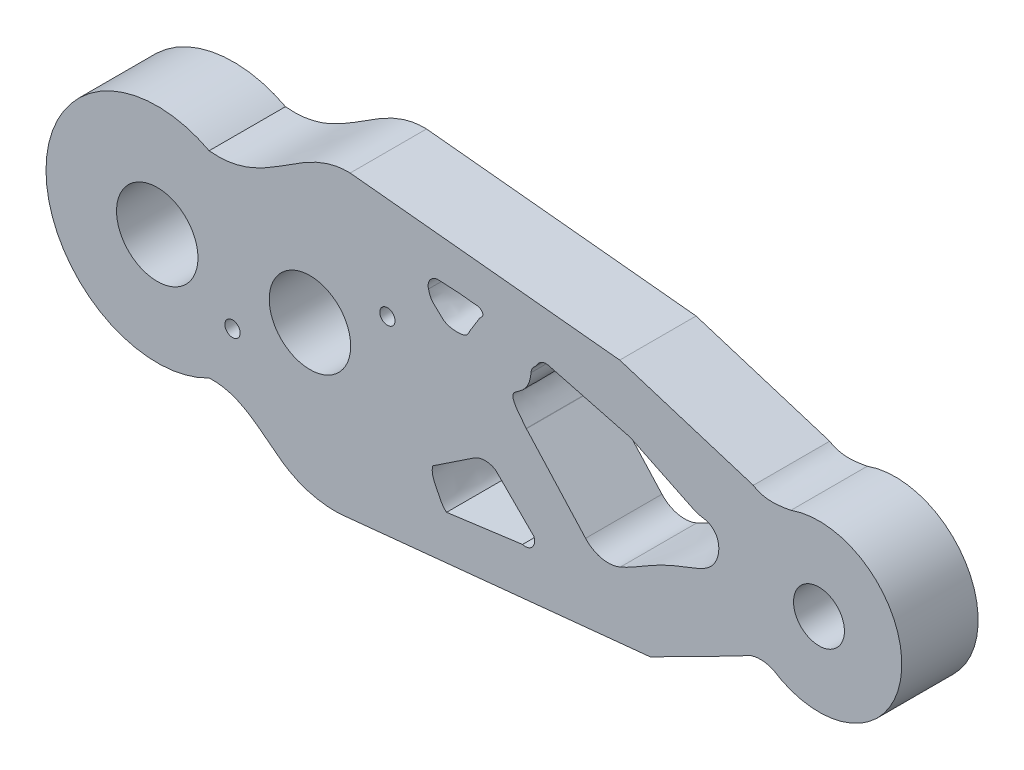
from build123d import *

# Parameters (mm, degrees)
SKETCH1_R               = 4
SKETCH1_R_2             = 2.5
BOSS_EXTRUDE1_DEPTH     = 3.75
CUT_EXTRUDE1_DEPTH      = 62.965246239
CUT_EXTRUDE1_DEPTH_BACK = 62.965246239
FILLET_1MM_R            = 1
FILLET_3MM_R            = 3
SKETCH4_R               = 0.75
SKETCH4_R_2             = 0.751178993
CUT_EXTRUDE2_DEPTH      = 61.458819785


with BuildPart() as part:
    # Sketch1 → Boss-Extrude1 (new, symmetric)
    with BuildSketch(Plane.XY):
        with BuildLine():
            Line((1.370602209, 14.9582984), (51.004064798, 9.949465005))
            ThreePointArc((51.004064798, 9.949465005), (60, 0), (51.004064798, -9.949465005))
            Line((51.004064798, -9.949465005), (1.370602209, -14.9582984))
            ThreePointArc((1.370602209, -14.9582984), (0.289429434, -15.018171395), (-0.793247409, -15))
            Line((-0.793247409, -15), (-15, -15))
            ThreePointArc((-15, -15), (-29.999996344, -0.010472716), (-15.020945427, 14.999985376))
            Line((-15.020945427, 14.999985376), (0, 15.020960071))
            ThreePointArc((0, 15.020960071), (0.686016928, 15.005286476), (1.370602209, 14.9582984))
        make_face()
        with Locations((-15, 0)):
            Circle(SKETCH1_R, mode=Mode.SUBTRACT)
        Circle(SKETCH1_R, mode=Mode.SUBTRACT)
        with Locations((50, 0)):
            Circle(SKETCH1_R_2, mode=Mode.SUBTRACT)
    extrude(amount=BOSS_EXTRUDE1_DEPTH, both=True)

    # Sketch3 → Cut-Extrude1 (cut, two sides: drawn at the far end of the back side and taken through both)
    with BuildSketch(Plane.XY.offset(-CUT_EXTRUDE1_DEPTH_BACK)):
        with BuildLine():
            add(Edge.make_bspline(
                [(-9.903552514, -9.666856323), (-7.476526803, -9.533199131), (-5.112477631, -11.33215709), (-1.419900227, -14.307798132), (1.248258646, -14.893104181), (3.011734347, -14.792681153)],
                knots=[0, 0, 0, 0, 0.454121396, 0.625343613, 1, 1, 1, 1], degree=3))
            Line((3.011734347, -14.792681153), (3.011734347, -19.334119217))
            Line((3.011734347, -19.334119217), (-33.098360308, -19.334119217))
            Line((-33.098360308, -19.334119217), (-33.098360308, 23.598998457))
            Line((-33.098360308, 23.598998457), (3.949930574, 23.598998457))
            Line((3.949930574, 23.598998457), (3.949930574, 14.69800171))
            add(Edge.make_bspline(
                [(-9.903552514, 9.666856323), (-6.652147518, 9.320096166), (-2.575157403, 12.180713674), (1.739923007, 14.763020307), (3.949930574, 14.69800171)],
                knots=[0, 0, 0, 0, 0.582391985, 1, 1, 1, 1], degree=3))
            ThreePointArc((-9.903552514, 9.666856323), (-25.928032217, 0), (-9.903552514, -9.666856323))
        make_face()
        with BuildLine():
            Line((13.422041161, -9.429006863), (20.881371876, -8.43126199))
            ThreePointArc((20.881371876, -8.43126199), (21.847495605, -8.160320639), (21.975684975, -7.165146401))
            Line((21.975684975, -7.165146401), (18.229705834, -3.41916726))
            ThreePointArc((18.229705834, -3.41916726), (17.156423485, -3.135604097), (16.097610829, -3.469158928))
            Line((16.097610829, -3.469158928), (12.06197208, -6.153326887))
            add(Edge.make_bspline(
                [(12.06197208, -6.153326887), (11.880071817, -6.848989266), (12.495445712, -7.927745141), (12.96639196, -9.063942624), (13.422041161, -9.429006863)],
                knots=[0, 0, 0, 0, 0.534201907, 1, 1, 1, 1], degree=3))
        make_face()
        with BuildLine():
            add(Edge.make_bspline(
                [(15.674640659, 7.098513093), (15.49672397, 6.468182077), (14.496468627, 6.357357892), (13.234107622, 6.56446163), (12.574974034, 7.320216924), (11.846331825, 7.907204564), (11.592995194, 8.901133679), (11.380851032, 9.582622864), (11.437882459, 10.014131639)],
                knots=[0, 0, 0, 0, 0.243008467, 0.400784189, 0.557347039, 0.677228271, 0.810823164, 1, 1, 1, 1], degree=3))
            Line((11.437882459, 10.014131639), (14.687582297, 9.83190548))
            Line((14.687582297, 9.83190548), (16.206133624, 9.666856323))
            add(Edge.make_bspline(
                [(16.206133624, 9.666856323), (16.619100034, 9.733976993), (17.408112438, 9.27156347), (16.707255561, 8.768919552)],
                knots=[0, 0, 0, 0, 1, 1, 1, 1], degree=3))
            Line((16.707255561, 8.768919552), (15.674640659, 7.098513093))
        make_face()
        with BuildLine():
            add(Edge.make_bspline(
                [(21.729031688, 6.823806783), (21.939045039, 7.341434845), (22.486267271, 7.383655673), (22.515916332, 8.313571308)],
                knots=[0.760302032, 0.760302032, 0.760302032, 0.760302032, 1, 1, 1, 1], degree=3))
            Line((22.515916332, 8.313571308), (31.469621951, 5.963223583))
            Line((31.469621951, 5.963223583), (38.184901166, 2.717505296))
            add(Edge.make_bspline(
                [(38.184901166, 2.717505296), (40.464447122, 2.725575269), (40.567260603, -0.931942624), (37.022828715, -2.289970909), (33.197915496, -3.793907945), (30.519351146, -5.92883722), (28.289027453, -6.153326887)],
                knots=[0, 0, 0, 0, 0.267174641, 0.422388406, 0.624449878, 1, 1, 1, 1], degree=3))
            Line((28.289027453, -6.153326887), (21.255156217, 1.611176601))
            add(Edge.make_bspline(
                [(21.255156217, 1.611176601), (18.09754055, 5.332684448), (21.561206138, 3.149309214), (21.729031688, 6.823806783)],
                knots=[0, 0, 0, 0, 1, 1, 1, 1], degree=3))
        make_face()
        with BuildLine():
            ThreePointArc((45.492416587, -6.772728508), (58.076251026, -0.980983712), (47.2448713, 7.654895527))
            add(Edge.make_bspline(
                [(43.548434402, 7.933716322), (44.667988914, 7.224515292), (46.028250353, 7.426448696), (47.2448713, 7.654895527)],
                knots=[0, 0, 0, 0, 1, 1, 1, 1], degree=3))
            Line((43.548434402, 7.933716322), (30.429215287, 12.025806005))
            Line((30.429215287, 12.025806005), (30.429215287, 19.726367019))
            Line((30.429215287, 19.726367019), (61.718394051, 19.726367019))
            Line((61.718394051, 19.726367019), (61.718394051, -17.852413161))
            Line((61.718394051, -17.852413161), (30.429215287, -17.852413161))
            Line((30.429215287, -17.852413161), (30.429215287, -13.246391922))
            Line((30.429215287, -13.246391922), (42.404870508, -7.165146401))
            add(Edge.make_bspline(
                [(42.404870508, -7.165146401), (43.791319621, -6.125801539), (45.492416587, -6.772728508)],
                knots=[0, 0, 0, 1, 1, 1], degree=2))
        make_face()
    extrude(amount=CUT_EXTRUDE1_DEPTH + CUT_EXTRUDE1_DEPTH_BACK, mode=Mode.SUBTRACT)

    # Fillet_1mm
    fillet_1mm_edges = [part.edges().sort_by_distance(p)[0] for p in [
        (14.687582297, 9.83190548, 0),
        (11.437882459, 10.014131639, -1.875),
        (21.255156217, 1.611176601, -1.875),
        (31.469621951, 5.963223583, 0),
        (22.515916332, 8.313571308, -1.875),
        (21.729031688, 6.823806783, -1.875),
        (15.674640659, 7.098513093, -1.875),
        (16.707255561, 8.768919552, -1.875),
        (16.206133624, 9.666856323, -1.875),
    ]]
    fillet(fillet_1mm_edges, radius=FILLET_1MM_R)

    # Fillet_3mm
    fillet_3mm_edges = [part.edges().sort_by_distance(p)[0] for p in [
        (28.289027453, -6.153326887, 1.875),
        (38.184901166, 2.717505296, -1.875),
    ]]
    fillet(fillet_3mm_edges, radius=FILLET_3MM_R)

    # Sketch4 → Cut-Extrude2 (cut, through all)
    with BuildSketch(Plane.XY.offset(3.75)):
        with Locations((7.606394585, 4.324957968)):
            Circle(SKETCH4_R)
        with Locations((-7.606394585, -4.324957968)):
            Circle(SKETCH4_R_2)
    extrude(amount=-CUT_EXTRUDE2_DEPTH, mode=Mode.SUBTRACT)


solid = part.part
